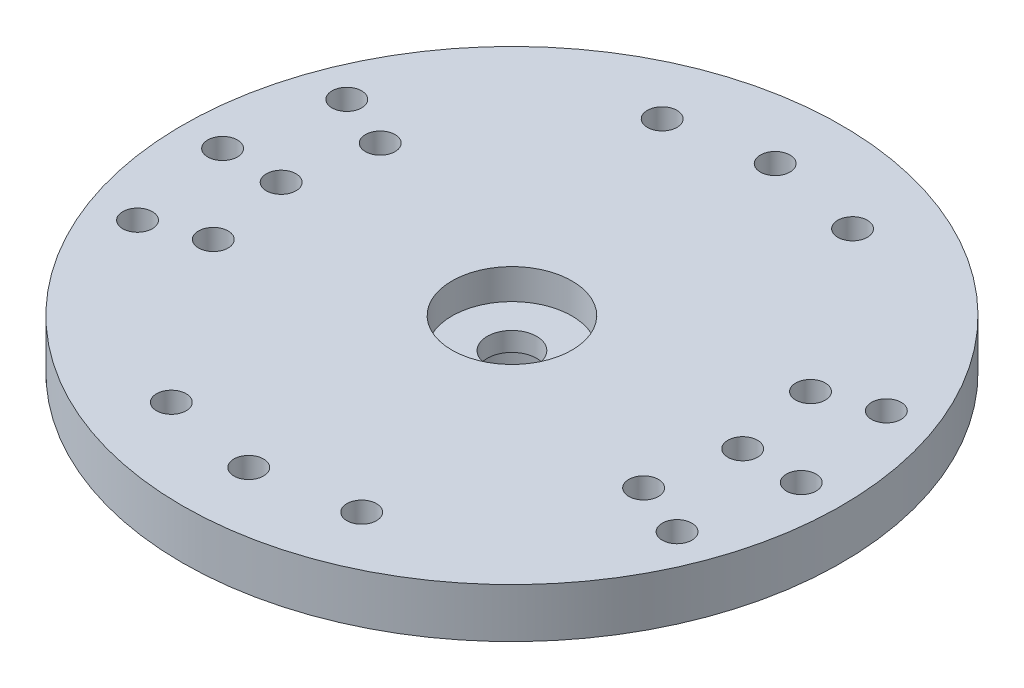
from build123d import *

# Parameters (mm, degrees)
SKETCH1_R           = 11.8618
SKETCH1_R_2         = 0.889
BOSS_EXTRUDE1_DEPTH = 1.778
SKETCH2_R           = 3.4417
SKETCH2_R_2         = 2.19075
BOSS_EXTRUDE2_DEPTH = 3.048
CUT_EXTRUDE1_START  = -1.0922
SKETCH3_R           = 2.159
SKETCH3_R_2         = 0.889
CUT_EXTRUDE1_DEPTH  = 1.0922
SKETCH4_R           = 0.5334
CUT_EXTRUDE2_DEPTH  = 18.455511292


with BuildPart() as part:
    # Sketch1 → Boss-Extrude1 (new body)
    with BuildSketch(Plane(origin=(0, 0, 0), x_dir=(1, 0, 0), z_dir=(0, 1, 0))):
        with Locations(Location((0, 0, 0), (0, 0, 270))):
            Circle(SKETCH1_R)
        with Locations(Location((0, 0, 0), (0, 0, 270))):
            Circle(SKETCH1_R_2, mode=Mode.SUBTRACT)
    extrude(amount=BOSS_EXTRUDE1_DEPTH)

    # Sketch2 → Boss-Extrude2 (add)
    with BuildSketch(Plane.XZ):
        with Locations(Location((0, 0, 0), (0, 0, 90))):
            Circle(SKETCH2_R)
        with Locations(Location((0, 0, 0), (0, 0, 90))):
            Circle(SKETCH2_R_2, mode=Mode.SUBTRACT)
    extrude(amount=BOSS_EXTRUDE2_DEPTH)

    # Sketch3 → Cut-Extrude1 (cut)
    with BuildSketch(Plane(origin=(0, 1.778, 0), x_dir=(1, 0, 0), z_dir=(0, 1, 0)).offset(CUT_EXTRUDE1_START)):
        with Locations(Location((0, 0, 0), (0, 0, 270))):
            Circle(SKETCH3_R)
        with Locations(Location((0, 0, 0), (0, 0, 270))):
            Circle(SKETCH3_R_2, mode=Mode.SUBTRACT)
    extrude(amount=CUT_EXTRUDE1_DEPTH, mode=Mode.SUBTRACT)

    # Sketch4 → Cut-Extrude2 (cut, through all)
    with BuildSketch(Plane(origin=(0, 1.778, 0), x_dir=(1, 0, 0), z_dir=(0, 1, 0))):
        with Locations(Location((0, 9.4742, 0), (0, 0, 270))):
            Circle(SKETCH4_R)
        with Locations(Location((10.414, 0, 0), (0, 0, 270))):
            Circle(SKETCH4_R)
        with Locations(Location((8.3058, 0, 0), (0, 0, 270))):
            Circle(SKETCH4_R)
        with Locations(Location((3.425780113, 8.833147585, 0), (0, 0, 270))):
            Circle(SKETCH4_R)
        with Locations(Location((-3.425780113, 8.833147585, 0), (0, 0, 270))):
            Circle(SKETCH4_R)
        with Locations(Location((7.743695028, 3.003581354, 0), (0, 0, 270))):
            Circle(SKETCH4_R)
        with Locations(Location((9.709220066, 3.765958273, 0), (0, 0, 270))):
            Circle(SKETCH4_R)
        with Locations(Location((7.743695028, -3.003581354, 0), (0, 0, 270))):
            Circle(SKETCH4_R)
        with Locations(Location((9.709220066, -3.765958273, 0), (0, 0, 270))):
            Circle(SKETCH4_R)
        with Locations(Location((3.425780113, -8.833147585, 0), (0, 0, 270))):
            Circle(SKETCH4_R)
        with Locations(Location((0, -9.4742, 0), (0, 0, 270))):
            Circle(SKETCH4_R)
        with Locations(Location((-3.425780113, -8.833147585, 0), (0, 0, 270))):
            Circle(SKETCH4_R)
        with Locations(Location((-9.709220066, -3.765958273, 0), (0, 0, 270))):
            Circle(SKETCH4_R)
        with Locations(Location((-7.743695028, -3.003581354, 0), (0, 0, 270))):
            Circle(SKETCH4_R)
        with Locations(Location((-9.709220066, 3.765958273, 0), (0, 0, 270))):
            Circle(SKETCH4_R)
        with Locations(Location((-7.743695028, 3.003581354, 0), (0, 0, 270))):
            Circle(SKETCH4_R)
        with Locations(Location((-8.3058, 0, 0), (0, 0, 270))):
            Circle(SKETCH4_R)
        with Locations(Location((-10.414, 0, 0), (0, 0, 270))):
            Circle(SKETCH4_R)
    extrude(amount=-CUT_EXTRUDE2_DEPTH, mode=Mode.SUBTRACT)


solid = part.part
